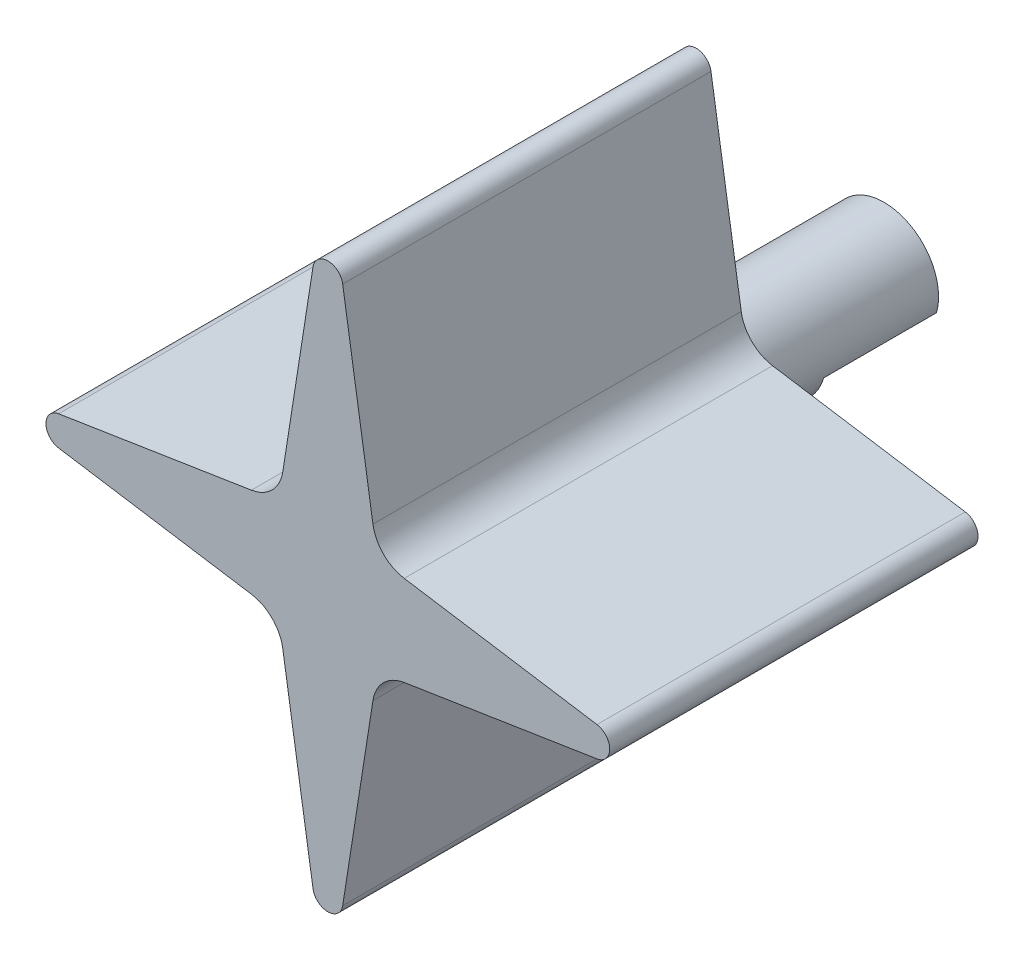
from build123d import *

# Parameters (mm, degrees)
BOSS_EXTRUDE1_DEPTH = 49
FILLET1_R           = 5
SKETCH2_R           = 7.25
BOSS_EXTRUDE2_DEPTH = 25
CUT_EXTRUDE1_START  = -15
CUT_EXTRUDE1_DEPTH  = 15


with BuildPart() as part:
    # Sketch1 → Boss-Extrude1 (new body)
    with BuildSketch(Plane.XY):
        with BuildLine():
            Line((-6.562511766, 6.562511766), (-1.975851033, 35.809859155))
            ThreePointArc((-1.975851033, 35.809859155), (0, 37.5), (1.975851033, 35.809859155))
            Line((1.975851033, 35.809859155), (6.562511766, 6.562511766))
            Line((6.562511766, 6.562511766), (35.809859155, 1.975851033))
            ThreePointArc((35.809859155, 1.975851033), (37.5, 0), (35.809859155, -1.975851033))
            Line((35.809859155, -1.975851033), (6.562511766, -6.562511766))
            Line((6.562511766, -6.562511766), (1.975851033, -35.809859155))
            ThreePointArc((1.975851033, -35.809859155), (0, -37.5), (-1.975851033, -35.809859155))
            Line((-1.975851033, -35.809859155), (-6.562511766, -6.562511766))
            Line((-6.562511766, -6.562511766), (-35.809859155, -1.975851033))
            ThreePointArc((-35.809859155, -1.975851033), (-37.5, 0), (-35.809859155, 1.975851033))
            Line((-35.809859155, 1.975851033), (-6.562511766, 6.562511766))
        make_face()
    extrude(amount=BOSS_EXTRUDE1_DEPTH)

    # Fillet1
    fillet1_edges = [part.edges().sort_by_distance(p)[0] for p in [
        (-6.562511766, 6.562511766, 24.5),
        (6.562511766, 6.562511766, 24.5),
        (6.562511766, -6.562511766, 24.5),
        (-6.562511766, -6.562511766, 24.5),
    ]]
    fillet(fillet1_edges, radius=FILLET1_R)

    # Sketch2 → Boss-Extrude2 (add)
    with BuildSketch(Plane(origin=(0, 0, 0), x_dir=(-1, 0, 0), z_dir=(0, 0, -1))):
        with Locations(Location((0, 0, 0), (0, 0, 180))):
            Circle(SKETCH2_R)
    extrude(amount=BOSS_EXTRUDE2_DEPTH)

    # Sketch3 → Cut-Extrude1 (cut)
    with BuildSketch(Plane(origin=(0, 0, -25), x_dir=(-1, 0, 0), z_dir=(0, 0, -1)).offset(CUT_EXTRUDE1_START)):
        with BuildLine():
            Line((6.968679932, -2), (-6.968679932, -2))
            ThreePointArc((-6.968679932, -2), (0, -7.25), (6.968679932, -2))
        make_face()
    extrude(amount=CUT_EXTRUDE1_DEPTH, mode=Mode.SUBTRACT)


solid = part.part
